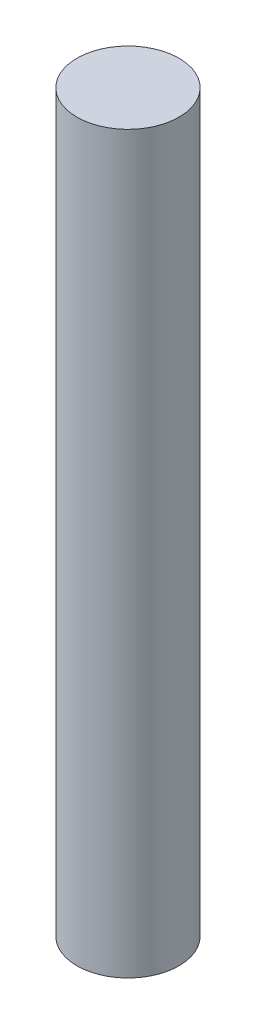
from build123d import *

# Parameters (mm, degrees)
SKETCH1_R           = 2.5
BOSS_EXTRUDE1_DEPTH = 36


with BuildPart() as part:
    # Sketch1 → Boss-Extrude1 (new body)
    with BuildSketch(Plane(origin=(0, 0, 0), x_dir=(1, 0, 0), z_dir=(0, 1, 0))):
        with Locations(Location((0, 0, 0), (0, 0, 270))):
            Circle(SKETCH1_R)
    extrude(amount=BOSS_EXTRUDE1_DEPTH)


solid = part.part
